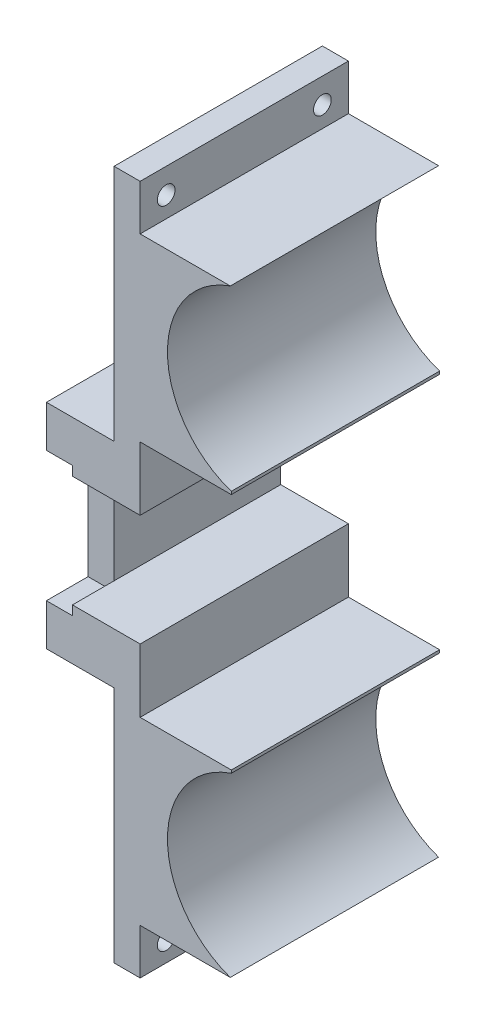
from build123d import *

# Parameters (mm, degrees)
BOSS_EXTRUDE1_DEPTH  = 40
M3_CLEARANCE_HOLE1_D = 3.4
SKETCH6_W            = 5
SKETCH6_H            = 25
CUT_EXTRUDE1_DEPTH   = 8
M3_CLEARANCE_HOLE2_D = 3.4


with BuildPart() as part:
    # Sketch1 → Boss-Extrude1 (new body)
    with BuildSketch(Plane.XY):
        with BuildLine():
            Line((5, 0), (0, 0))
            Line((0, 0), (0, -20.5))
            Line((0, -20.5), (13, -20.5))
            Line((13, -20.5), (13, -66.25))
            Line((13, -66.25), (18, -66.25))
            Line((18, -66.25), (18, -57.5))
            Line((18, -57.5), (35.314368035, -57.5))
            ThreePointArc((35.314368035, -57.5), (23.250292021, -40.40428558), (35.508342613, -23.447116675))
            Line((35.508342613, -23.447116675), (35.508342613, -22.9))
            Line((35.508342613, -22.9), (18, -22.9))
            Line((18, -22.9), (18, -10.7))
            Line((18, -10.7), (5, -10.7))
            Line((5, -10.7), (5, 0))
        make_face()
    boss_extrude1 = extrude(amount=BOSS_EXTRUDE1_DEPTH)

    # Mirror1: Boss-Extrude1 across plane
    add(boss_extrude1.mirror(Plane.ZX))

    # M3 Clearance Hole1 (through all)
    with Locations(Plane.ZY.offset(-13)):
        with Locations((35, -62.481816862), (5, -62.481816862), (35, 61.468183138), (5, 61.468183138)):
            Hole(M3_CLEARANCE_HOLE1_D / 2)

    # Sketch6 → Cut-Extrude1 (cut)
    with BuildSketch(Plane(origin=(0, 0, 40), x_dir=(-1, 0, 0), z_dir=(0, 0, -1))):
        with Locations((-2.5, 0)):
            Rectangle(SKETCH6_W, SKETCH6_H)
    extrude(amount=CUT_EXTRUDE1_DEPTH, mode=Mode.SUBTRACT)

    # M3 Clearance Hole2 (through all)
    with Locations(Plane.ZY):
        with Locations((20, 0)):
            Hole(M3_CLEARANCE_HOLE2_D / 2)


solid = part.part
